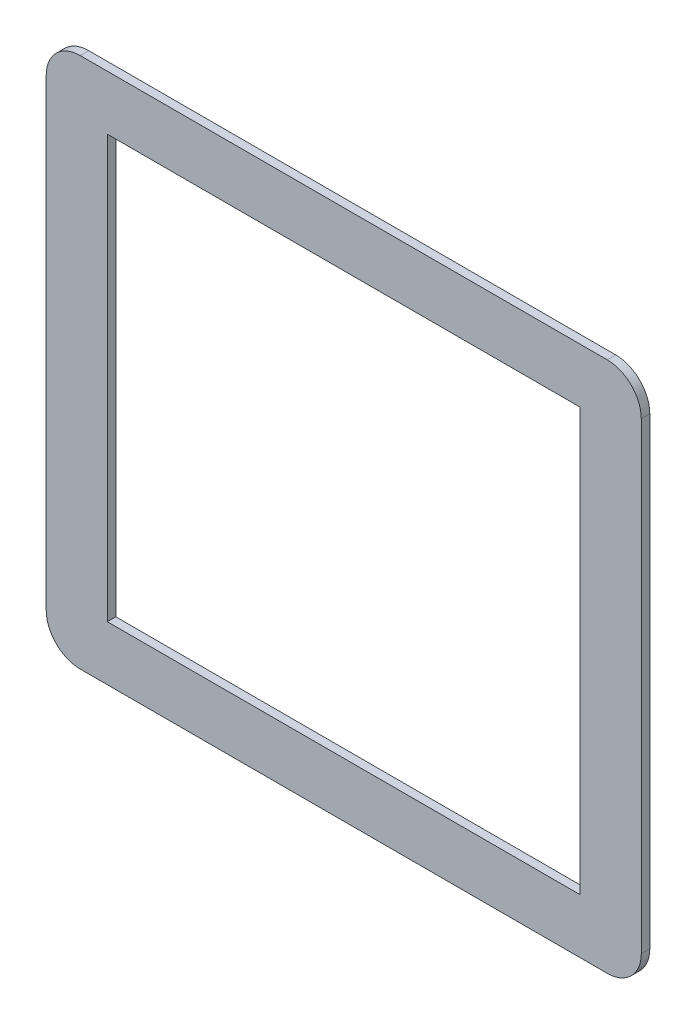
from build123d import *

# Parameters (mm, degrees)
SKETCH1_W           = 222.503016192
SKETCH1_H           = 198.663407314
BOSS_EXTRUDE1_DEPTH = 4


with BuildPart() as part:
    # Sketch1 → Boss-Extrude1 (new body)
    with BuildSketch(Plane.XY):
        with BuildLine():
            Line((-124, 125), (124, 125))
            ThreePointArc((124, 125), (135.313708499, 120.313708499), (140, 109))
            Line((140, 109), (140, -109))
            ThreePointArc((140, -109), (135.313708499, -120.313708499), (124, -125))
            Line((124, -125), (-124, -125))
            ThreePointArc((-124, -125), (-135.313708499, -120.313708499), (-140, -109))
            Line((-140, -109), (-140, 109))
            ThreePointArc((-140, 109), (-135.313708499, 120.313708499), (-124, 125))
        make_face()
        Rectangle(SKETCH1_W, SKETCH1_H, mode=Mode.SUBTRACT)
    extrude(amount=BOSS_EXTRUDE1_DEPTH)


solid = part.part
